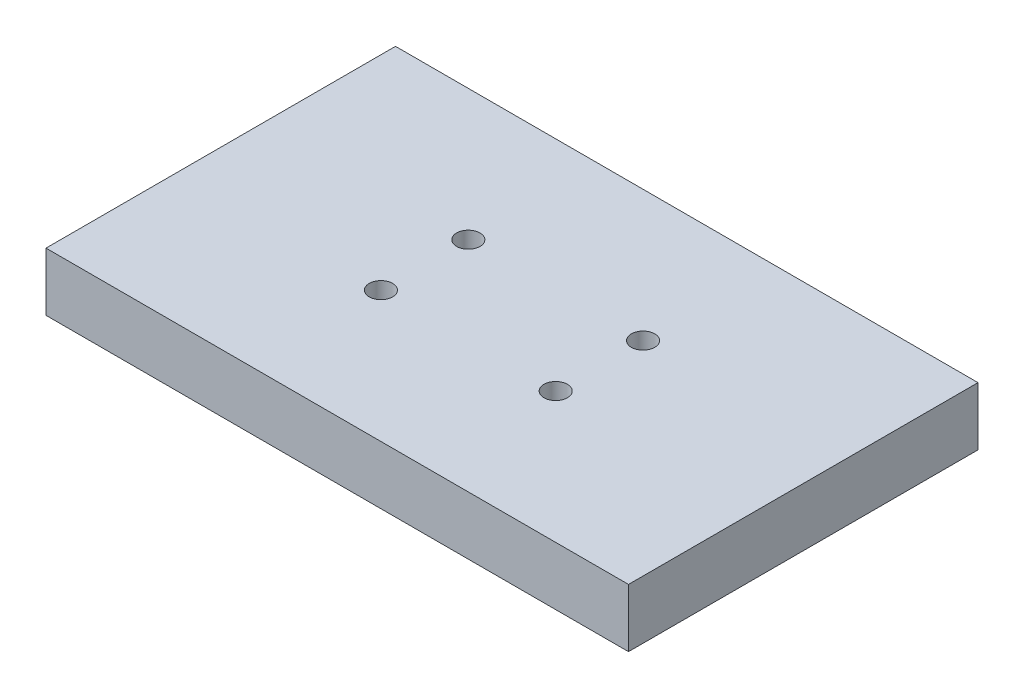
from build123d import *

# Parameters (mm, degrees)
SKETCH1_W                  = 127
SKETCH1_H                  = 76.2
BOSS_EXTRUDE1_DEPTH        = 12.7
F_7_0_201_DIAMETER_HOLE1_D = 5.1054


with BuildPart() as part:
    # Sketch1 → Boss-Extrude1 (new body)
    with BuildSketch(Plane(origin=(0, 0, 0), x_dir=(1, 0, 0), z_dir=(0, 1, 0))):
        with Locations((-63.5, 38.1)):
            Rectangle(SKETCH1_W, SKETCH1_H)
    extrude(amount=BOSS_EXTRUDE1_DEPTH)

    # #7 (0.201) Diameter Hole1 (through all)
    with Locations(Plane(origin=(0, 12.7, 0), x_dir=(1, 0, 0), z_dir=(0, 1, 0))):
        with Locations((-82.55, 47.625), (-82.55, 28.575), (-44.45, 28.575), (-44.45, 47.625)):
            Hole(F_7_0_201_DIAMETER_HOLE1_D / 2)


solid = part.part
